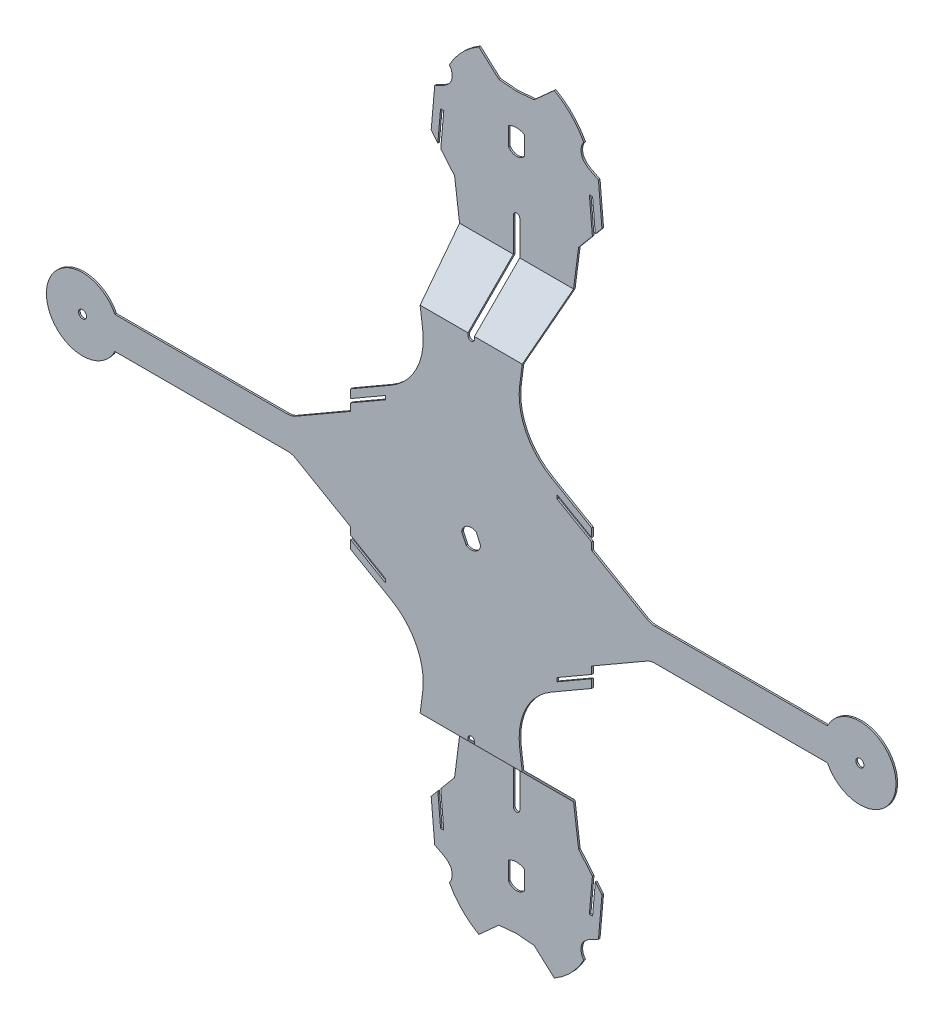
from build123d import *

# Parameters (mm, degrees)
SALIENTE_EXTRUIR1_DEPTH     = 271
CORTAR_EXTRUIR9_DEPTH       = 371.311303012
CORTAR_EXTRUIR9_DEPTH_BACK  = 371.311303012
CROQUIS4_R                  = 2.5
CORTAR_EXTRUIR10_DEPTH      = 371.311303012
CORTAR_EXTRUIR10_DEPTH_BACK = 371.311303012
CROQUIS2_W                  = 600.899293422
CROQUIS2_H                  = 554.061756016
REDONDEO1_R                 = 40
REDONDEO2_R                 = 10


with BuildPart() as part:
    # Croquis1 → Saliente-Extruir1 (new, symmetric)
    with BuildSketch(Plane(origin=(0, 0, 0), x_dir=(0, 0, -1), z_dir=(1, 0, 0))):
        Polygon((17.5, 0), (17.5, 110), (45.748915908, 138.248915908), (45.748915908, 248), (46.748915908, 248), (46.748915908, 137.834702346), (18.5, 109.585786438), (18.5, 0), (18.5, -109.585786438), (46.748915908, -137.834702346), (46.748915908, -248), (45.748915908, -248), (45.748915908, -138.248915908), (17.5, -110), align=None)
    extrude(amount=SALIENTE_EXTRUIR1_DEPTH, both=True)

    # Croquis4 → Cortar-Extruir9 (cut, two sides: drawn at the far end of the back side and taken through both)
    with BuildSketch(Plane.XY.offset(-CORTAR_EXTRUIR9_DEPTH_BACK)):
        with Locations((-242, 0)):
            Circle(CROQUIS4_R)
        with Locations((242, 0)):
            Circle(CROQUIS4_R)
        with BuildLine():
            Line((-5, 201.31662479), (-5, 194.68337521))
            ThreePointArc((-5, 194.68337521), (0, 192), (5, 194.68337521))
            Line((5, 194.68337521), (5, 201.31662479))
            Line((5, 201.31662479), (5, 206.077747211))
            ThreePointArc((5, 206.077747211), (0, 207.5), (-5, 206.077747211))
            Line((-5, 206.077747211), (-5, 201.31662479))
        make_face()
        with BuildLine():
            Line((5, -201.31662479), (5, -194.68337521))
            Line((5, -194.68337521), (5, -189.922252789))
            ThreePointArc((5, -189.922252789), (0, -188.5), (-5, -189.922252789))
            Line((-5, -189.922252789), (-5, -194.68337521))
            Line((-5, -194.68337521), (-5, -201.31662479))
            ThreePointArc((-5, -201.31662479), (0, -204), (5, -201.31662479))
        make_face()
        with BuildLine():
            Line((-5.933205139, 0.892791565), (-3.129872731, -5.118974183))
            ThreePointArc((-3.129872731, -5.118974183), (2.53570957, -5.437846722), (5.933205139, -0.892791565))
            Line((5.933205139, -0.892791565), (3.129872731, 5.118974183))
            ThreePointArc((3.129872731, 5.118974183), (-2.53570957, 5.437846722), (-5.933205139, 0.892791565))
        make_face()
    extrude(amount=CORTAR_EXTRUIR9_DEPTH + CORTAR_EXTRUIR9_DEPTH_BACK, mode=Mode.SUBTRACT)

    # Croquis2 → Cortar-Extruir10 (cut, two sides: drawn at the far end of the back side and taken through both)
    # profile 1 of 3: a face of its own
    with BuildSketch(Plane.XY.offset(-CORTAR_EXTRUIR10_DEPTH_BACK)):
        Rectangle(CROQUIS2_W, CROQUIS2_H)
        with BuildLine():
            Line((-53.168424061, 179.61105261), (-50.970090866, 204.738116011))
            add(Edge.make_bspline(
                [(-50.970090866, 204.738116011), (-47.792962615, 206.268732201), (-40.787060156, 209.02456014), (-39.883059345, 216.418425991), (-40.736802152, 219.176084752), (-41.896759663, 220.381052918)],
                knots=[0, 0, 0, 0, 0.610720728, 0.773572895, 1, 1, 1, 1], degree=3))
            ThreePointArc((-41.896759663, 220.381052918), (-34.036336447, 231.13273006), (-23.5, 239.279534881))
            Line((-23.5, 239.279534881), (-11, 228.04191018))
            Line((-11, 228.04191018), (0, 227.079534881))
            Line((0, 227.079534881), (11, 228.04191018))
            Line((11, 228.04191018), (23.5, 239.279534881))
            ThreePointArc((23.5, 239.279534881), (34.036336447, 231.13273006), (41.896759663, 220.381052918))
            add(Edge.make_bspline(
                [(50.970090866, 204.738116011), (47.792962615, 206.268732201), (40.787060156, 209.02456014), (39.883059345, 216.418425991), (40.736802152, 219.176084752), (41.896759663, 220.381052918)],
                knots=[0, 0, 0, 0, 0.610720728, 0.773572895, 1, 1, 1, 1], degree=3))
            Line((50.970090866, 204.738116011), (53.168424061, 179.61105261))
            Line((53.168424061, 179.61105261), (49.023071172, 174.670813412))
            Line((49.023071172, 174.670813412), (47.331626671, 194.00411253))
            Line((47.331626671, 194.00411253), (45.323986996, 194.00411253))
            Line((45.323986996, 194.00411253), (47.204993262, 172.50411253))
            Line((47.204993262, 172.50411253), (38.602496631, 162.252056265))
            Line((38.602496631, 162.252056265), (26.75, 71.158420678))
            Line((26.75, 71.158420678), (75, 43.301270189))
            Line((75, 43.301270189), (75, 38.035835734))
            Line((75, 38.035835734), (53.5, 50.448866522))
            Line((53.5, 50.448866522), (53.5, 48.139465445))
            Line((53.5, 48.139465445), (75, 35.726434657))
            Line((75, 35.726434657), (75, 31.166434657))
            Line((75, 31.166434657), (111.661340242, 10))
            Line((111.661340242, 10), (221.844355629, 10))
            ThreePointArc((221.844355629, 10), (264.5, 0), (221.844355629, -10))
            Line((221.844355629, -10), (111.661340242, -10))
            Line((111.661340242, -10), (75, -31.166434657))
            Line((75, -31.166434657), (75, -35.726434657))
            Line((75, -35.726434657), (53.5, -48.139465445))
            Line((53.5, -48.139465445), (53.5, -50.448866522))
            Line((53.5, -50.448866522), (75, -38.035835734))
            Line((75, -38.035835734), (75, -43.301270189))
            Line((75, -43.301270189), (26.75, -71.158420678))
            Line((26.75, -71.158420678), (38.602496631, -162.252056265))
            Line((38.602496631, -162.252056265), (47.204993262, -172.50411253))
            Line((47.204993262, -172.50411253), (45.323986996, -194.00411253))
            Line((45.323986996, -194.00411253), (47.331626671, -194.00411253))
            Line((47.331626671, -194.00411253), (49.023071172, -174.670813412))
            Line((49.023071172, -174.670813412), (53.168424061, -179.61105261))
            Line((53.168424061, -179.61105261), (50.970090866, -204.738116011))
            add(Edge.make_bspline(
                [(50.970090866, -204.738116011), (47.792962615, -206.268732201), (40.787060156, -209.02456014), (39.883059345, -216.418425991), (40.736802152, -219.176084752), (41.896759663, -220.381052918)],
                knots=[0, 0, 0, 0, 0.610720728, 0.773572895, 1, 1, 1, 1], degree=3))
            ThreePointArc((41.896759663, -220.381052918), (34.036336447, -231.13273006), (23.5, -239.279534881))
            Line((23.5, -239.279534881), (11, -228.04191018))
            Line((11, -228.04191018), (0, -227.079534881))
            Line((0, -227.079534881), (-11, -228.04191018))
            Line((-11, -228.04191018), (-23.5, -239.279534881))
            ThreePointArc((-23.5, -239.279534881), (-34.036336447, -231.13273006), (-41.896759663, -220.381052918))
            add(Edge.make_bspline(
                [(-50.970090866, -204.738116011), (-47.792962615, -206.268732201), (-40.787060156, -209.02456014), (-39.883059345, -216.418425991), (-40.736802152, -219.176084752), (-41.896759663, -220.381052918)],
                knots=[0, 0, 0, 0, 0.610720728, 0.773572895, 1, 1, 1, 1], degree=3))
            Line((-50.970090866, -204.738116011), (-53.168424061, -179.61105261))
            Line((-53.168424061, -179.61105261), (-49.023071172, -174.670813412))
            Line((-49.023071172, -174.670813412), (-47.331626671, -194.00411253))
            Line((-47.331626671, -194.00411253), (-45.323986996, -194.00411253))
            Line((-45.323986996, -194.00411253), (-47.204993262, -172.50411253))
            Line((-47.204993262, -172.50411253), (-38.602496631, -162.252056265))
            Line((-38.602496631, -162.252056265), (-26.75, -71.158420678))
            Line((-26.75, -71.158420678), (-75, -43.301270189))
            Line((-75, -43.301270189), (-75, -38.035835734))
            Line((-75, -38.035835734), (-53.5, -50.448866522))
            Line((-53.5, -50.448866522), (-53.5, -48.139465445))
            Line((-53.5, -48.139465445), (-75, -35.726434657))
            Line((-75, -35.726434657), (-75, -31.166434657))
            Line((-75, -31.166434657), (-111.661340242, -10))
            Line((-111.661340242, -10), (-221.844355629, -10))
            ThreePointArc((-221.844355629, -10), (-264.5, 0), (-221.844355629, 10))
            Line((-221.844355629, 10), (-111.661340242, 10))
            Line((-111.661340242, 10), (-75, 31.166434657))
            Line((-75, 31.166434657), (-75, 35.726434657))
            Line((-75, 35.726434657), (-53.5, 48.139465445))
            Line((-53.5, 48.139465445), (-53.5, 50.448866522))
            Line((-53.5, 50.448866522), (-75, 38.035835734))
            Line((-75, 38.035835734), (-75, 43.301270189))
            Line((-75, 43.301270189), (-26.75, 71.158420678))
            Line((-26.75, 71.158420678), (-38.602496631, 162.252056265))
            Line((-38.602496631, 162.252056265), (-47.204993262, 172.50411253))
            Line((-47.204993262, 172.50411253), (-45.323986996, 194.00411253))
            Line((-45.323986996, 194.00411253), (-47.331626671, 194.00411253))
            Line((-47.331626671, 194.00411253), (-49.023071172, 174.670813412))
            Line((-49.023071172, 174.670813412), (-53.168424061, 179.61105261))
        make_face(mode=Mode.SUBTRACT)
    # profile 2 of 3: a face of its own
    with BuildSketch(Plane.XY.offset(-CORTAR_EXTRUIR10_DEPTH_BACK)):
        with BuildLine():
            Line((-2, -108.5), (-2, -159.5))
            ThreePointArc((-2, -159.5), (0, -161.5), (2, -159.5))
            Line((2, -159.5), (2, -108.5))
            ThreePointArc((2, -108.5), (0, -106.5), (-2, -108.5))
        make_face()
    # profile 3 of 3: a face of its own
    with BuildSketch(Plane.XY.offset(-CORTAR_EXTRUIR10_DEPTH_BACK)):
        with BuildLine():
            Line((-2, 108.5), (-2, 159.5))
            ThreePointArc((-2, 159.5), (0, 161.5), (2, 159.5))
            Line((2, 159.5), (2, 108.5))
            ThreePointArc((2, 108.5), (0, 106.5), (-2, 108.5))
        make_face()
    extrude(amount=CORTAR_EXTRUIR10_DEPTH + CORTAR_EXTRUIR10_DEPTH_BACK, mode=Mode.SUBTRACT)

    # Redondeo1
    redondeo1_edges = [part.edges().sort_by_distance(p)[0] for p in [
        (-26.75, 71.158420678, -18),
        (-26.75, -71.158420678, -18),
        (26.75, -71.158420678, -18),
        (26.75, 71.158420678, -18),
    ]]
    fillet(redondeo1_edges, radius=REDONDEO1_R)

    # Redondeo2
    redondeo2_edges = [part.edges().sort_by_distance(p)[0] for p in [
        (-111.661340242, 10, -18),
        (-111.661340242, -10, -18),
        (111.661340242, -10, -18),
        (111.661340242, 10, -18),
    ]]
    fillet(redondeo2_edges, radius=REDONDEO2_R)


solid = part.part
